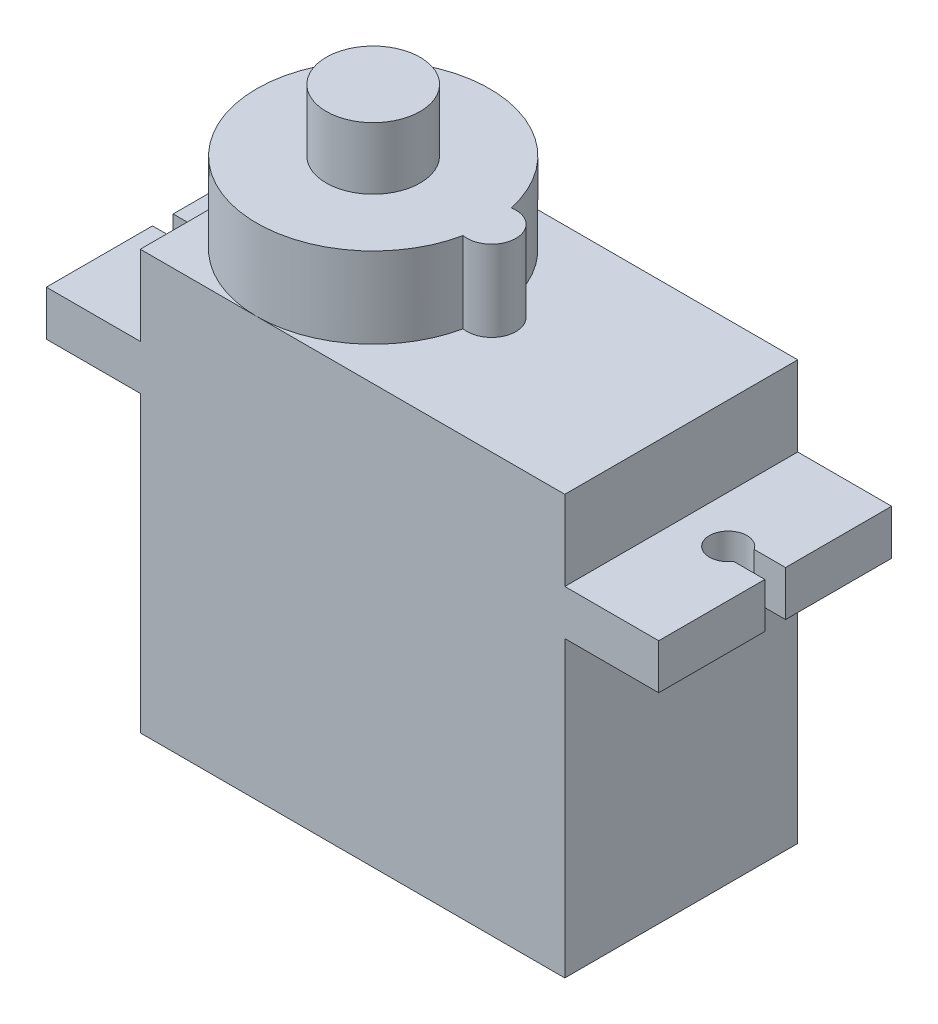
from build123d import *

# Parameters (mm, degrees)
SKETCH1_W             = 22.6
SKETCH1_H             = 12.4
BOSS_EXTRUDE1_DEPTH   = 22.3
SKETCH2_W             = 12.4
SKETCH2_H             = 2.4
BOSS_EXTRUDE2_DEPTH   = 5
SKETCH3_W             = 12.4
SKETCH3_H             = 2.4
BOSS_EXTRUDE3_DEPTH   = 5
CUT_EXTRUDE1_REACH    = 27.098
BOSS_EXTRUDE4_DEPTH   = 4.3
SKETCH7_R             = 2.5
BOSS_EXTRUDE5_DEPTH   = 3.3
SKETCH8_R             = 0.6
BOSS_EXTRUDE7_DEPTH   = 2.3
BOSS_EXTRUDE7_2_DEPTH = 2.3
BOSS_EXTRUDE7_3_DEPTH = 2.3


with BuildPart() as part:
    # Sketch1 → Boss-Extrude1 (new body)
    with BuildSketch(Plane(origin=(0, 0, 0), x_dir=(1, 0, 0), z_dir=(0, 1, 0))):
        Rectangle(SKETCH1_W, SKETCH1_H)
    extrude(amount=BOSS_EXTRUDE1_DEPTH)

    # Sketch2 → Boss-Extrude2 (add)
    with BuildSketch(Plane(origin=(11.3, 0, 0), x_dir=(0, 0, -1), z_dir=(1, 0, 0))):
        with Locations((0, 16.85)):
            Rectangle(SKETCH2_W, SKETCH2_H)
    extrude(amount=BOSS_EXTRUDE2_DEPTH)

    # Sketch3 → Boss-Extrude3 (add)
    with BuildSketch(Plane.ZY.offset(11.3)):
        with Locations((0, 16.85)):
            Rectangle(SKETCH3_W, SKETCH3_H)
    extrude(amount=BOSS_EXTRUDE3_DEPTH)

    # Sketch4 → Cut-Extrude1 (cut, up to next)
    with BuildSketch(Plane(origin=(0, 18.05, 0), x_dir=(1, 0, 0), z_dir=(0, 1, 0)), mode=Mode.PRIVATE) as cut_extrude1_sk1:
        with BuildLine():
            Line((-16.3, 0.55), (-14.635164654, 0.55))
            ThreePointArc((-14.635164654, 0.55), (-12.8, 0), (-14.635164654, -0.55))
            Line((-14.635164654, -0.55), (-16.3, -0.55))
            Line((-16.3, -0.55), (-16.3, 0.55))
        make_face()
    cut_extrude1_tool1 = extrude(cut_extrude1_sk1.sketch, amount=-CUT_EXTRUDE1_REACH, mode=Mode.PRIVATE) & part.part
    # Sketch4 → Cut-Extrude1 (cut, up to next)
    with BuildSketch(Plane(origin=(0, 18.05, 0), x_dir=(1, 0, 0), z_dir=(0, 1, 0)), mode=Mode.PRIVATE) as cut_extrude1_sk2:
        with BuildLine():
            Line((16.3, -0.55), (14.635164654, -0.55))
            ThreePointArc((14.635164654, -0.55), (12.8, 0), (14.635164654, 0.55))
            Line((14.635164654, 0.55), (16.3, 0.55))
            Line((16.3, 0.55), (16.3, -0.55))
        make_face()
    cut_extrude1_tool2 = extrude(cut_extrude1_sk2.sketch, amount=-CUT_EXTRUDE1_REACH, mode=Mode.PRIVATE) & part.part
    add(cut_extrude1_tool1.solids().sort_by_distance((-14.40681, 18.05, 0))[0], mode=Mode.SUBTRACT)
    add(cut_extrude1_tool2.solids().sort_by_distance((14.40681, 18.05, 0))[0], mode=Mode.SUBTRACT)

    # Sketch6 → Boss-Extrude4 (add)
    with BuildSketch(Plane(origin=(0, 22.3, 0), x_dir=(1, 0, 0), z_dir=(0, 1, 0))):
        with BuildLine():
            ThreePointArc((0.966666667, -1.278888406), (2.5, 0), (0.966666667, 1.278888406))
            ThreePointArc((0.966666667, 1.278888406), (-11.3, 0), (0.966666667, -1.278888406))
        make_face()
    extrude(amount=BOSS_EXTRUDE4_DEPTH)

    # Sketch7 → Boss-Extrude5 (add)
    with BuildSketch(Plane(origin=(0, 26.6, 0), x_dir=(1, 0, 0), z_dir=(0, 1, 0))):
        with Locations(Location((-5.1, 0, 0), (0, 0, 270))):
            Circle(SKETCH7_R)
    extrude(amount=BOSS_EXTRUDE5_DEPTH)


with BuildPart() as body_2:
    # Sketch8 → Boss-Extrude7 (new body)
    with BuildSketch(Plane.ZY.offset(11.3)):
        with Locations((0, 4.5)):
            Circle(SKETCH8_R)
    extrude(amount=BOSS_EXTRUDE7_DEPTH)


with BuildPart() as body_3:
    # Sketch8 → Boss-Extrude7 2 (new body)
    with BuildSketch(Plane.ZY.offset(11.3)):
        with Locations((-1.2, 4.5)):
            Circle(SKETCH8_R)
    extrude(amount=BOSS_EXTRUDE7_2_DEPTH)


with BuildPart() as body_4:
    # Sketch8 → Boss-Extrude7 3 (new body)
    with BuildSketch(Plane.ZY.offset(11.3)):
        with Locations((1.2, 4.5)):
            Circle(SKETCH8_R)
    extrude(amount=BOSS_EXTRUDE7_3_DEPTH)


solid = Compound([part.part, body_2.part, body_3.part, body_4.part])
